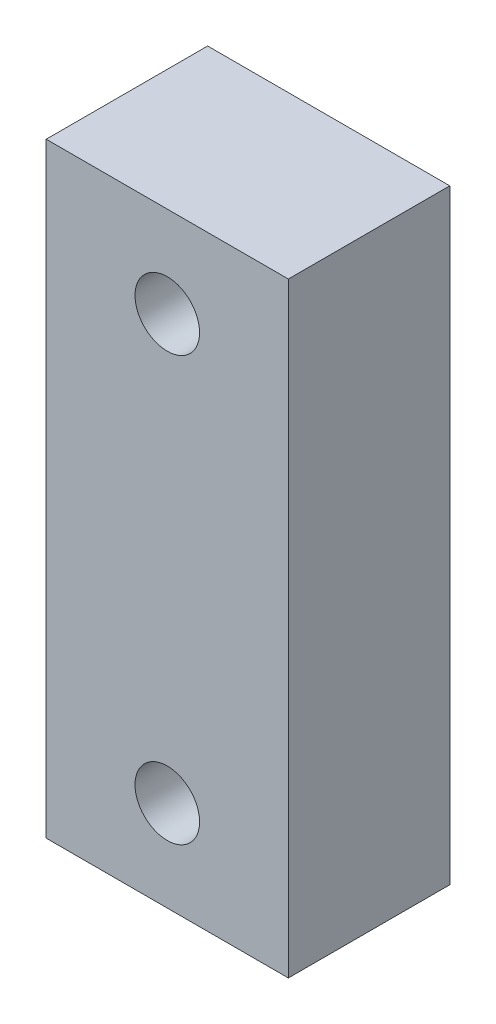
from build123d import *

# Parameters (mm, degrees)
SKETCH_1_W      = 30
SKETCH_1_H      = 75
SKETCH_1_R      = 4
EXTRUDE_1_DEPTH = 20


with BuildPart() as part:
    # 草图1 → 凸台-拉伸1 (new body)
    with BuildSketch(Plane.XY):
        Rectangle(SKETCH_1_W, SKETCH_1_H)
        with Locations((0, 26.25)):
            Circle(SKETCH_1_R, mode=Mode.SUBTRACT)
        with Locations((0, -26.25)):
            Circle(SKETCH_1_R, mode=Mode.SUBTRACT)
    extrude(amount=EXTRUDE_1_DEPTH)


solid = part.part
